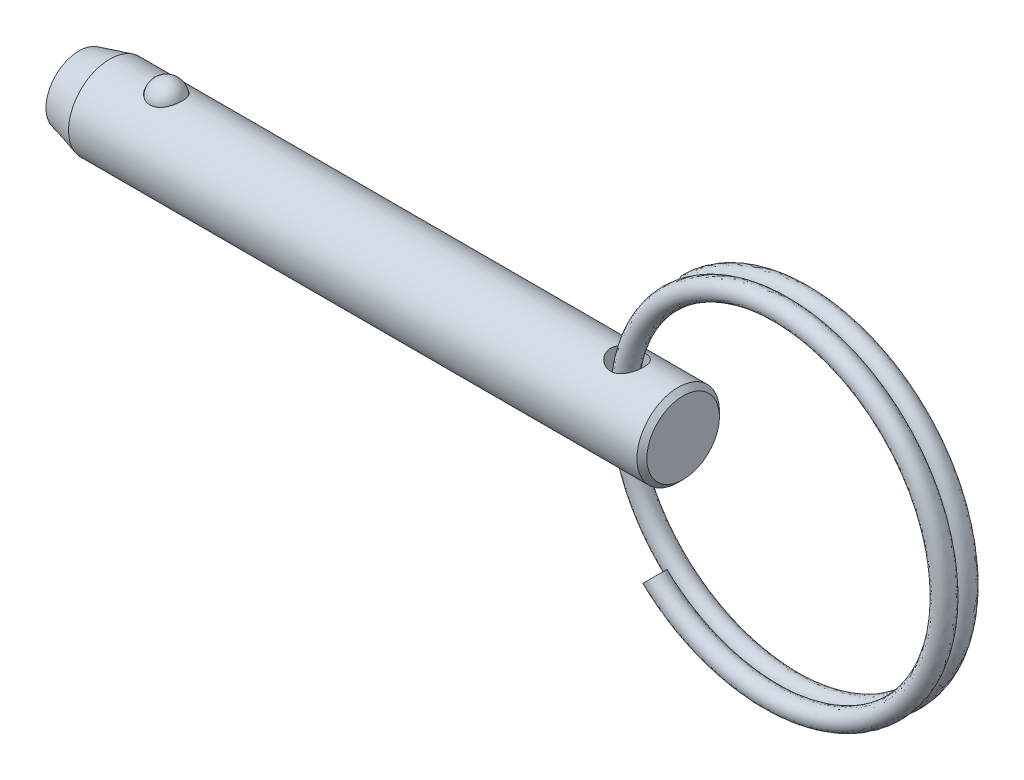
from build123d import *

# Parameters (mm, degrees)
SKETCH4_W          = 1.27
SKETCH4_H          = 6.35
SWEEP1_PITCH       = 1.5494
SWEEP1_HEIGHT      = 1.355725
SWEEP1_RADIUS      = 13.462
SKETCH6_R          = 0.762
SWEEP2_PITCH       = 1.5494
SWEEP2_HEIGHT      = 1.355725
SWEEP2_RADIUS      = 13.462
SWEEP2_START_ANGLE = -180
SKETCH6_2_R        = 0.762


with BuildPart() as part:
    # Sketch1 → Revolve1 (revolve)
    with BuildSketch(Plane.XY, mode=Mode.PRIVATE) as revolve1_sk:
        Polygon((23.2664, 2.794), (22.8854, 3.175), (-20.896547737, 3.175), (-23.2664, 2.54), (-23.2664, 0), (23.2664, 0), align=None)
    revolve(revolve1_sk.sketch.rotate(Axis((23.2664, 0, 0), (1, 0, 0)), 90), axis=Axis((23.2664, 0, 0), (1, 0, 0)))

    # Sketch2 → Cut-Revolve1 (revolve, cut)
    with BuildSketch(Plane.XY):
        with BuildLine():
            Line((-15.274582051, 2.8575), (-17.789182051, 2.8575))
            ThreePointArc((-17.789182051, 2.8575), (-16.531882051, 4.1148), (-15.274582051, 2.8575))
        make_face()
    revolve(axis=Axis((-15.274582051, 2.8575, 0), (1, 0, 0)), mode=Mode.SUBTRACT)

    # Sketch4 → Cut-Revolve2 (revolve, cut)
    with BuildSketch(Plane.XY, mode=Mode.PRIVATE) as cut_revolve2_sk:
        with Locations((19.5834, 0)):
            Rectangle(SKETCH4_W, SKETCH4_H)
    revolve(cut_revolve2_sk.sketch.rotate(Axis((18.9484, -3.175, 0), (0, 1, 0)), 90), axis=Axis((18.9484, -3.175, 0), (0, 1, 0)), mode=Mode.SUBTRACT)


with BuildPart() as body_2:
    # Sketch3 → Revolve2 (revolve)
    with BuildSketch(Plane.XY):
        with BuildLine():
            Line((-15.299982051, 2.8575), (-17.763782051, 2.8575))
            ThreePointArc((-17.763782051, 2.8575), (-16.531882051, 4.0894), (-15.299982051, 2.8575))
        make_face()
    revolve(axis=Axis((-15.299982051, 2.8575, 0), (1, 0, 0)))


with BuildPart() as body_3:
    # Sweep1: sweep along a helix
    with BuildLine() as sweep1_path:
        Helix(SWEEP1_PITCH, SWEEP1_HEIGHT, SWEEP1_RADIUS, center=(31.433425091, 0, 0), direction=(0, 0, -1), lefthand=True)
    # Sketch6 → Sweep1 (sweep)
    with BuildSketch(Plane(origin=(114.003847968, 0, 0), x_dir=(0, 0, -1), z_dir=(0, 1, 0))):
        with Locations((0, 95.270422877)):
            Circle(SKETCH6_R)
    sweep(path=sweep1_path.line, is_frenet=True)

    # Sweep2: sweep along a helix
    with BuildLine() as sweep2_path:
        add(Helix(SWEEP2_PITCH, SWEEP2_HEIGHT, SWEEP2_RADIUS, center=(31.433425091, 0, 0), direction=(0, 0, 1), lefthand=True, mode=Mode.PRIVATE).rotate(Axis((31.433425091, 0, 0), (0, 0, 1)), SWEEP2_START_ANGLE))
    # Sketch6<2> → Sweep2 (sweep)
    with BuildSketch(Plane(origin=(114.003847968, 0, 0), x_dir=(0, 0, -1), z_dir=(0, 1, 0))):
        with Locations((0, 95.270422877)):
            Circle(SKETCH6_2_R)
    sweep(path=sweep2_path.line, is_frenet=True)


solid = Compound([part.part, body_2.part, body_3.part])
